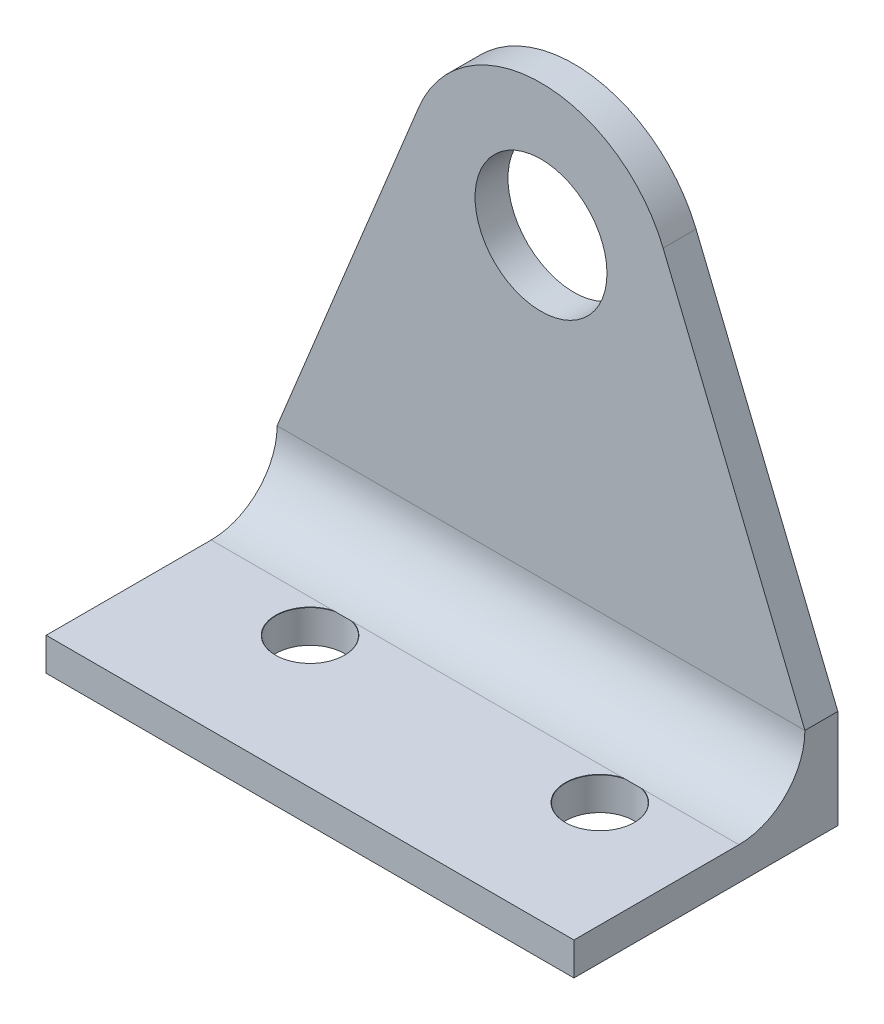
from build123d import *

# Parameters (mm, degrees)
BOSS_EXTRUDE1_DEPTH           = 25.4
FILLET1_R                     = 6.35
M6_CLEARANCE_HOLE1_AT_2_COUNT = 2
M6_CLEARANCE_HOLE1_AT_2_PITCH = 27.890807904
SKETCH4_R                     = 6.35
CUT_EXTRUDE1_DEPTH            = 59.37764812


with BuildPart() as part:
    # Sketch1 → Boss-Extrude1 (new, symmetric)
    with BuildSketch(Plane(origin=(0, 0, 0), x_dir=(0, 0, -1), z_dir=(1, 0, 0))):
        Polygon((0, 0), (22.23, 0), (22.23, 47.63), (25.4, 47.63), (25.4, -3.17), (0, -3.17), align=None)
    extrude(amount=BOSS_EXTRUDE1_DEPTH, both=True)

    # Fillet1
    fillet1_edges = [part.edges().sort_by_distance(p)[0] for p in [
        (0, 0, -22.23),
    ]]
    fillet(fillet1_edges, radius=FILLET1_R)

    # Sketch3 → M6 Clearance Hole1 (revolve, cut)
    with BuildSketch(Plane(origin=(-12.7, 0, -12.7), x_dir=(0, 0, 1), z_dir=(1, 0, 0))):
        Polygon((0, 0), (0, 3.17), (3.3, 3.17), (3.3, 0.025), (3.325, 0), align=None)
    m6_clearance_hole1 = revolve(axis=Axis((-12.7, 6.35, -12.7), (0, -1, 0)), mode=Mode.SUBTRACT)

    # M6 Clearance Hole1 at 2: M6 Clearance Hole1 ×2
    with Locations(*[(i * M6_CLEARANCE_HOLE1_AT_2_PITCH, 0, 0) for i in range(1, M6_CLEARANCE_HOLE1_AT_2_COUNT)]):
        add(m6_clearance_hole1, mode=Mode.SUBTRACT)

    # Sketch4 → Cut-Extrude1 (cut, through all)
    with BuildSketch(Plane.XY.offset(-22.23)):
        with Locations((0, 34.93)):
            Circle(SKETCH4_R)
        with BuildLine():
            Line((25.4, 47.63), (-3e-08, 47.63))
            ThreePointArc((-3e-08, 47.63), (7.080670019, 45.472965052), (11.756103406, 39.734584552))
            Line((11.756103406, 39.734584552), (25.4, 6.35))
            Line((25.4, 6.35), (25.4, 47.63))
        make_face()
        with BuildLine():
            Line((-25.4, 47.63), (-25.4, 6.35))
            Line((-25.4, 6.35), (-11.756103406, 39.734584552))
            ThreePointArc((-11.756103406, 39.734584552), (-7.080670044, 45.472965035), (-3e-08, 47.63))
            Line((-3e-08, 47.63), (-25.4, 47.63))
        make_face()
    extrude(amount=-CUT_EXTRUDE1_DEPTH, mode=Mode.SUBTRACT)


solid = part.part
